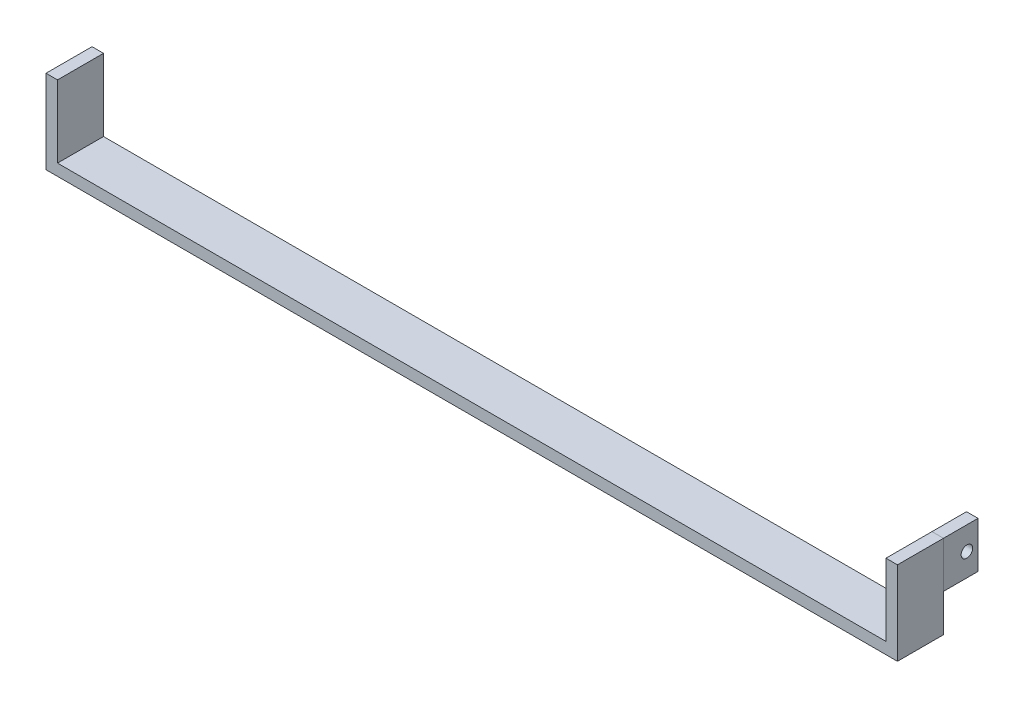
from build123d import *

# Parameters (mm, degrees)
SKETCH1_W           = 370
SKETCH1_H           = 20
BOSS_EXTRUDE1_DEPTH = 5
SKETCH2_W           = 5
SKETCH2_H           = 20
BOSS_EXTRUDE2_DEPTH = 31.32
SKETCH3_W           = 5
SKETCH3_H           = 20
BOSS_EXTRUDE3_DEPTH = 15
SKETCH4_R           = 2.5
CUT_EXTRUDE1_DEPTH  = 15


with BuildPart() as part:
    # Sketch1 → Boss-Extrude1 (new body)
    with BuildSketch(Plane(origin=(0, 0, 0), x_dir=(1, 0, 0), z_dir=(0, 1, 0))):
        with Locations((185, 10)):
            Rectangle(SKETCH1_W, SKETCH1_H)
    extrude(amount=BOSS_EXTRUDE1_DEPTH)

    # Sketch2 → Boss-Extrude2 (add)
    with BuildSketch(Plane(origin=(0, 5, 0), x_dir=(1, 0, 0), z_dir=(0, 1, 0))):
        with Locations((2.5, 10)):
            Rectangle(SKETCH2_W, SKETCH2_H)
        with Locations((367.5, 10)):
            Rectangle(SKETCH2_W, SKETCH2_H)
    extrude(amount=BOSS_EXTRUDE2_DEPTH)


with BuildPart() as body_2:
    # Sketch3 → Boss-Extrude3 (new body)
    with BuildSketch(Plane(origin=(0, 0, -20), x_dir=(-1, 0, 0), z_dir=(0, 0, -1))):
        with Locations((-367.5, 26.32)):
            Rectangle(SKETCH3_W, SKETCH3_H)
    extrude(amount=BOSS_EXTRUDE3_DEPTH)

    # Sketch4 → Cut-Extrude1 (cut)
    with BuildSketch(Plane(origin=(370, 0, 0), x_dir=(0, 0, -1), z_dir=(1, 0, 0))):
        with Locations((30.17, 26.24)):
            Circle(SKETCH4_R)
    extrude(amount=-CUT_EXTRUDE1_DEPTH, mode=Mode.SUBTRACT)


solid = Compound([part.part, body_2.part])
